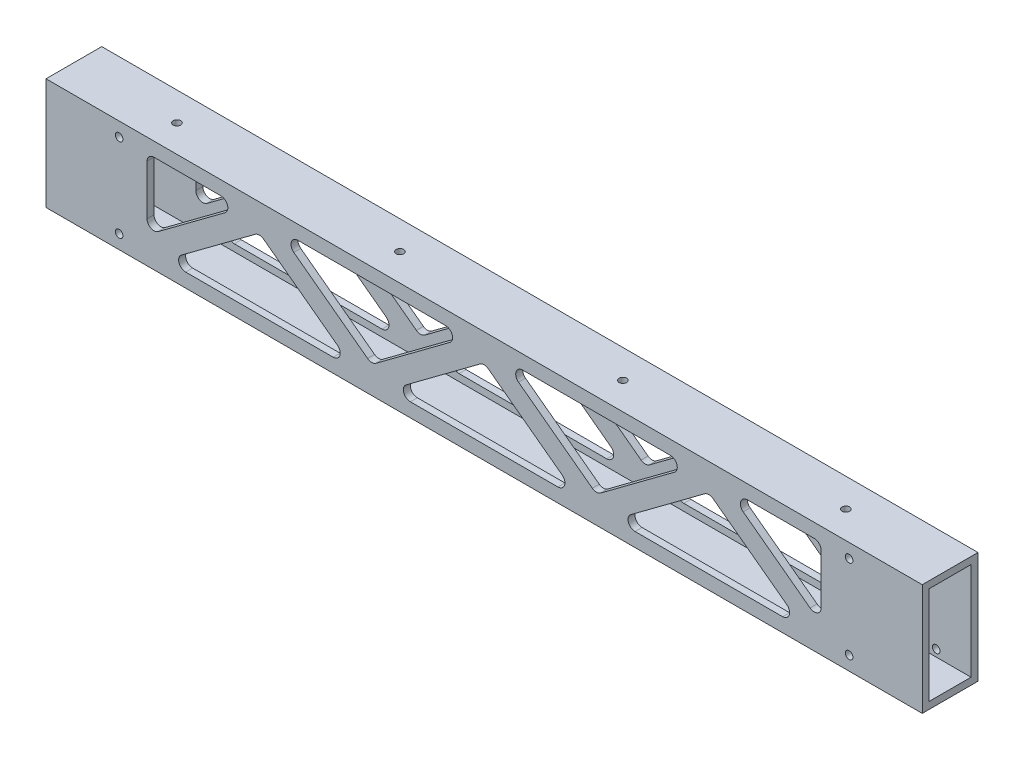
from build123d import *

# Parameters (mm, degrees)
SKETCH1_W                 = 25.4
SKETCH1_H                 = 50.8
SKETCH1_W_2               = 19.05
SKETCH1_H_2               = 44.45
BOSS_EXTRUDE1_DEPTH       = 199.62495
F_8_32_TAPPED_HOLE1_D     = 3.4544
F_8_32_TAPPED_HOLE1_DEPTH = 3.175
CUT_EXTRUDE2_DEPTH        = 203.831064343
FILLET1_R                 = 3.175
F_8_32_TAPPED_HOLE2_D     = 3.4544
F_8_32_TAPPED_HOLE2_DEPTH = 3.175
F_8_32_TAPPED_HOLE3_D     = 3.4544
F_8_32_TAPPED_HOLE3_DEPTH = 3.175


with BuildPart() as part:
    # Sketch1 → Boss-Extrude1 (new, symmetric)
    with BuildSketch(Plane(origin=(0, 0, 0), x_dir=(0, 0, -1), z_dir=(1, 0, 0))):
        Rectangle(SKETCH1_W, SKETCH1_H)
        Rectangle(SKETCH1_W_2, SKETCH1_H_2, mode=Mode.SUBTRACT)
    extrude(amount=BOSS_EXTRUDE1_DEPTH, both=True)

    # #8-32 Tapped Hole1
    with Locations(Plane.XY.offset(12.7)):
        with Locations((166.28745, 19.05), (166.28745, -19.05), (-166.28745, 19.05), (-166.28745, -19.05)):
            Hole(F_8_32_TAPPED_HOLE1_D / 2, depth=F_8_32_TAPPED_HOLE1_DEPTH)

    # Sketch5 → Cut-Extrude2 (cut, through all)
    with BuildSketch(Plane.XY.offset(12.7)):
        Polygon((-153.58745, 19.05), (-153.58745, -13.113403304), (-110.368770238, 19.05), align=None)
        Polygon((-145.610313096, -19.05), (-102.391633333, 13.113403304), (-59.172953571, -19.05), align=None)
        Polygon((-94.414496429, 19.05), (-7.977136904, 19.05), (-51.195816667, -13.113403304), align=None)
        Polygon((-43.218679762, -19.05), (0, 13.113403304), (43.218679762, -19.05), align=None)
        Polygon((94.414496429, 19.05), (51.195816667, -13.113403304), (7.977136904, 19.05), align=None)
        Polygon((59.172953571, -19.05), (102.391633333, 13.113403304), (145.610313096, -19.05), align=None)
        Polygon((110.368770238, 19.05), (153.58745, 19.05), (153.58745, -13.113403304), align=None)
    extrude(amount=-CUT_EXTRUDE2_DEPTH, mode=Mode.SUBTRACT)

    # Fillet1
    fillet1_edges = [part.edges().sort_by_distance(p)[0] for p in [
        (-94.414496429, 19.05, 11.1125),
        (-7.977136904, 19.05, 11.1125),
        (43.218679762, -19.05, -11.1125),
        (-43.218679762, -19.05, -11.1125),
        (0, 13.113403304, -11.1125),
        (43.218679762, -19.05, 11.1125),
        (-43.218679762, -19.05, 11.1125),
        (0, 13.113403304, 11.1125),
        (7.977136904, 19.05, -11.1125),
        (94.414496429, 19.05, -11.1125),
        (51.195816667, -13.113403304, -11.1125),
        (7.977136904, 19.05, 11.1125),
        (94.414496429, 19.05, 11.1125),
        (51.195816667, -13.113403304, 11.1125),
        (145.610313096, -19.05, -11.1125),
        (59.172953571, -19.05, -11.1125),
        (102.391633333, 13.113403304, -11.1125),
        (145.610313096, -19.05, 11.1125),
        (59.172953571, -19.05, 11.1125),
        (102.391633333, 13.113403304, 11.1125),
        (153.58745, -13.113403304, -11.1125),
        (110.368770238, 19.05, -11.1125),
        (153.58745, 19.05, -11.1125),
        (153.58745, -13.113403304, 11.1125),
        (110.368770238, 19.05, 11.1125),
        (153.58745, 19.05, 11.1125),
        (-153.58745, 19.05, -11.1125),
        (-110.368770238, 19.05, -11.1125),
        (-153.58745, -13.113403304, -11.1125),
        (-153.58745, 19.05, 11.1125),
        (-110.368770238, 19.05, 11.1125),
        (-153.58745, -13.113403304, 11.1125),
        (-59.172953571, -19.05, -11.1125),
        (-145.610313096, -19.05, -11.1125),
        (-102.391633333, 13.113403304, -11.1125),
        (-59.172953571, -19.05, 11.1125),
        (-145.610313096, -19.05, 11.1125),
        (-102.391633333, 13.113403304, 11.1125),
        (-51.195816667, -13.113403304, -11.1125),
        (-94.414496429, 19.05, -11.1125),
        (-7.977136904, 19.05, -11.1125),
        (-51.195816667, -13.113403304, 11.1125),
    ]]
    fillet(fillet1_edges, radius=FILLET1_R)

    # #8-32 Tapped Hole2
    with Locations(Plane(origin=(0, 0, -12.7), x_dir=(-1, 0, 0), z_dir=(0, 0, -1))):
        with Locations((-183.74995, 19.05), (-183.74995, -19.05), (183.74995, -19.05), (183.74995, 19.05)):
            Hole(F_8_32_TAPPED_HOLE2_D / 2, depth=F_8_32_TAPPED_HOLE2_DEPTH)

    # #8-32 Tapped Hole3
    with Locations(Plane(origin=(0, 25.4, 0), x_dir=(1, 0, 0), z_dir=(0, 1, 0))):
        with Locations((-152.4, -0.27178), (-50.8, -0.27178), (50.8, -0.27178), (152.4, -0.27178)):
            Hole(F_8_32_TAPPED_HOLE3_D / 2, depth=F_8_32_TAPPED_HOLE3_DEPTH)


solid = part.part
